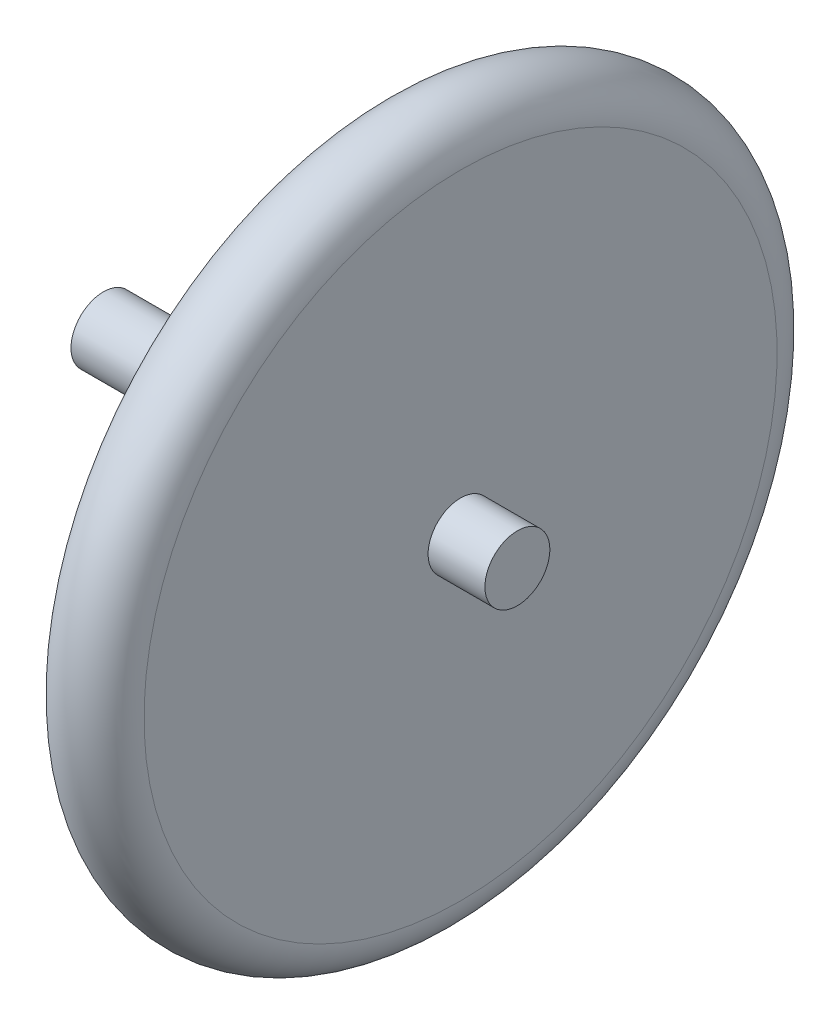
from build123d import *


with BuildPart() as part:
    # Esquisse1 → Révolution1 (revolve)
    with BuildSketch(Plane.XY):
        with BuildLine():
            Line((-2.5, 19.5), (-2.5, 2))
            Line((-2.5, 2), (-19.5, 2))
            Line((-19.5, 2), (-19.5, 0))
            Line((-19.5, 0), (0, 0))
            Line((0, 0), (6, 0))
            Line((6, 0), (6, 2))
            Line((6, 2), (2.5, 2))
            Line((2.5, 2), (2.5, 19.5))
            ThreePointArc((2.5, 19.5), (0, 22), (-2.5, 19.5))
        make_face()
    revolve(axis=Axis((0, 0, 0), (-1, 0, 0)))


solid = part.part
